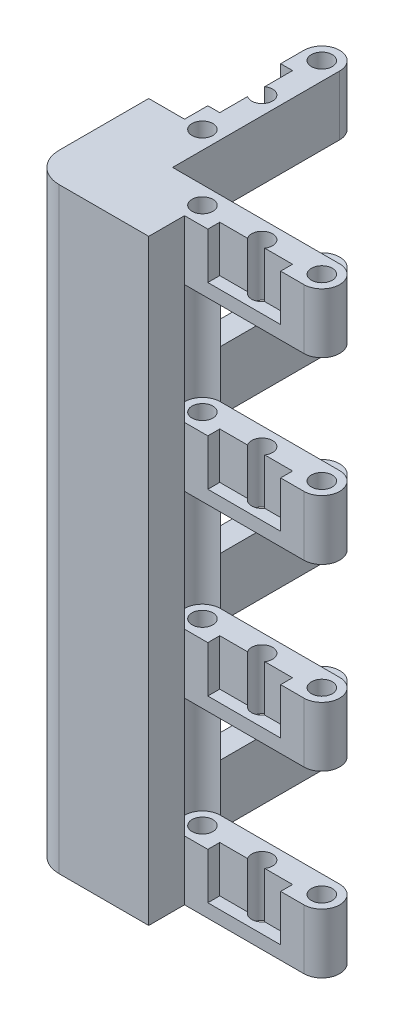
from build123d import *

# Parameters (mm, degrees)
BOSS_EXTRUDE1_DEPTH      = 50
BOSS_EXTRUDE1_DEPTH_BACK = 50
BOSS_EXTRUDE2_DEPTH      = 50
BOSS_EXTRUDE2_DEPTH_BACK = 50
FILLET1_R                = 5
CUT_EXTRUDE2_DEPTH       = 40
CUT_EXTRUDE2_DEPTH_BACK  = 40
BOSS_EXTRUDE3_DEPTH      = 20
BOSS_EXTRUDE3_DEPTH_BACK = 20
CUT_EXTRUDE3_DEPTH       = 10
CUT_EXTRUDE3_DEPTH_BACK  = 10
SKETCH3_R                = 1.75
CUT_EXTRUDE1_DEPTH       = 118.038455219
SKETCH4_W                = 12.2
SKETCH4_H                = 5.5
CUT_EXTRUDE4_DEPTH       = 2
LPATTERN1_COUNT          = 4
LPATTERN1_PITCH          = 30
SKETCH6_W                = 12.2
SKETCH6_H                = 5.5
CUT_EXTRUDE5_DEPTH       = 2
LPATTERN2_COUNT          = 4
LPATTERN2_PITCH          = 30
SKETCH7_W                = 12.2
SKETCH7_H                = 4
CUT_EXTRUDE6_DEPTH       = 2
LPATTERN3_COUNT          = 4
LPATTERN3_PITCH          = 30
SKETCH8_W                = 12.2
SKETCH8_H                = 4
CUT_EXTRUDE7_DEPTH       = 2
LPATTERN4_COUNT          = 4
LPATTERN4_PITCH          = 30


with BuildPart() as part:
    # Sketch1 → Boss-Extrude1 (new, two sides: drawn at the far end of the back side and taken through both)
    with BuildSketch(Plane(origin=(0, 0, 0), x_dir=(1, 0, 0), z_dir=(0, 1, 0)).offset(-BOSS_EXTRUDE1_DEPTH_BACK)):
        Polygon((0, 0), (0, 20), (12, 20), (12, 12), (20, 12), (20, 0), align=None)
    extrude(amount=BOSS_EXTRUDE1_DEPTH + BOSS_EXTRUDE1_DEPTH_BACK)

    # Sketch2 → Boss-Extrude2 (add, two sides: drawn at the far end of the back side and taken through both)
    with BuildSketch(Plane(origin=(0, 0, 0), x_dir=(1, 0, 0), z_dir=(0, 1, 0)).offset(-BOSS_EXTRUDE2_DEPTH_BACK)):
        with BuildLine():
            Line((20, 12), (40, 12))
            ThreePointArc((40, 12), (43, 9), (40, 6))
            Line((40, 6), (20, 6))
            ThreePointArc((20, 6), (17, 9), (20, 12))
        make_face()
        with BuildLine():
            Line((12, 40), (12, 20))
            ThreePointArc((12, 20), (9, 17), (6, 20))
            Line((6, 20), (6, 40))
            ThreePointArc((6, 40), (9, 43), (12, 40))
        make_face()
    extrude(amount=BOSS_EXTRUDE2_DEPTH + BOSS_EXTRUDE2_DEPTH_BACK)

    # Fillet1
    fillet1_edges = [part.edges().sort_by_distance(p)[0] for p in [
        (0, 0, 0),
    ]]
    fillet(fillet1_edges, radius=FILLET1_R)

    # Sketch2<2> → Cut-Extrude2 (cut, two sides: drawn at the far end of the back side and taken through both)
    with BuildSketch(Plane(origin=(0, 0, 0), x_dir=(1, 0, 0), z_dir=(0, 1, 0)).offset(-CUT_EXTRUDE2_DEPTH_BACK)):
        with BuildLine():
            Line((20, 12), (40, 12))
            ThreePointArc((40, 12), (43, 9), (40, 6))
            Line((40, 6), (20, 6))
            ThreePointArc((20, 6), (17, 9), (20, 12))
        make_face()
        with BuildLine():
            Line((12, 40), (12, 20))
            ThreePointArc((12, 20), (9, 17), (6, 20))
            Line((6, 20), (6, 40))
            ThreePointArc((6, 40), (9, 43), (12, 40))
        make_face()
    extrude(amount=CUT_EXTRUDE2_DEPTH + CUT_EXTRUDE2_DEPTH_BACK, mode=Mode.SUBTRACT)

    # Sketch2<3> → Boss-Extrude3 (add, two sides: drawn at the far end of the back side and taken through both)
    with BuildSketch(Plane(origin=(0, 0, 0), x_dir=(1, 0, 0), z_dir=(0, 1, 0)).offset(-BOSS_EXTRUDE3_DEPTH_BACK)):
        with BuildLine():
            Line((20, 12), (40, 12))
            ThreePointArc((40, 12), (43, 9), (40, 6))
            Line((40, 6), (20, 6))
            ThreePointArc((20, 6), (17, 9), (20, 12))
        make_face()
        with BuildLine():
            Line((12, 40), (12, 20))
            ThreePointArc((12, 20), (9, 17), (6, 20))
            Line((6, 20), (6, 40))
            ThreePointArc((6, 40), (9, 43), (12, 40))
        make_face()
    extrude(amount=BOSS_EXTRUDE3_DEPTH + BOSS_EXTRUDE3_DEPTH_BACK)

    # Sketch2<4> → Cut-Extrude3 (cut, two sides: drawn at the far end of the back side and taken through both)
    with BuildSketch(Plane(origin=(0, 0, 0), x_dir=(1, 0, 0), z_dir=(0, 1, 0)).offset(-CUT_EXTRUDE3_DEPTH_BACK)):
        with BuildLine():
            Line((20, 12), (40, 12))
            ThreePointArc((40, 12), (43, 9), (40, 6))
            Line((40, 6), (20, 6))
            ThreePointArc((20, 6), (17, 9), (20, 12))
        make_face()
        with BuildLine():
            Line((12, 40), (12, 20))
            ThreePointArc((12, 20), (9, 17), (6, 20))
            Line((6, 20), (6, 40))
            ThreePointArc((6, 40), (9, 43), (12, 40))
        make_face()
    extrude(amount=CUT_EXTRUDE3_DEPTH + CUT_EXTRUDE3_DEPTH_BACK, mode=Mode.SUBTRACT)

    # Sketch3 → Cut-Extrude1 (cut, through all)
    with BuildSketch(Plane(origin=(0, 50, 0), x_dir=(1, 0, 0), z_dir=(0, 1, 0))):
        with Locations((9, 40)):
            Circle(SKETCH3_R)
        with Locations((9, 20)):
            Circle(SKETCH3_R)
        with Locations((20, 9)):
            Circle(SKETCH3_R)
        with Locations((40, 9)):
            Circle(SKETCH3_R)
        with Locations((30, 9)):
            Circle(SKETCH3_R)
        with Locations((9, 30)):
            Circle(SKETCH3_R)
    extrude(amount=-CUT_EXTRUDE1_DEPTH, mode=Mode.SUBTRACT)

    # Sketch4 → Cut-Extrude4 (cut)
    with BuildSketch(Plane.XY.offset(-6)):
        with Locations((30, 45)):
            Rectangle(SKETCH4_W, SKETCH4_H)
    cut_extrude4 = extrude(amount=-CUT_EXTRUDE4_DEPTH, mode=Mode.SUBTRACT)

    # LPattern1: Cut-Extrude4 ×4
    with Locations(*[(0, -i * LPATTERN1_PITCH, 0) for i in range(1, LPATTERN1_COUNT)]):
        add(cut_extrude4, mode=Mode.SUBTRACT)

    # Sketch6 → Cut-Extrude5 (cut)
    with BuildSketch(Plane.ZY.offset(-6)):
        with Locations((-30, 45)):
            Rectangle(SKETCH6_W, SKETCH6_H)
    cut_extrude5 = extrude(amount=-CUT_EXTRUDE5_DEPTH, mode=Mode.SUBTRACT)

    # LPattern2: Cut-Extrude5 ×4
    with Locations(*[(0, -i * LPATTERN2_PITCH, 0) for i in range(1, LPATTERN2_COUNT)]):
        add(cut_extrude5, mode=Mode.SUBTRACT)

    # Sketch7 → Cut-Extrude6 (cut)
    with BuildSketch(Plane.ZY.offset(-6)):
        with Locations((-30, 49.75)):
            Rectangle(SKETCH7_W, SKETCH7_H)
    cut_extrude6 = extrude(amount=-CUT_EXTRUDE6_DEPTH, mode=Mode.SUBTRACT)

    # LPattern3: Cut-Extrude6 ×4
    with Locations(*[(0, -i * LPATTERN3_PITCH, 0) for i in range(1, LPATTERN3_COUNT)]):
        add(cut_extrude6, mode=Mode.SUBTRACT)

    # Sketch8 → Cut-Extrude7 (cut)
    with BuildSketch(Plane.XY.offset(-6)):
        with Locations((30, 49.75)):
            Rectangle(SKETCH8_W, SKETCH8_H)
    cut_extrude7 = extrude(amount=-CUT_EXTRUDE7_DEPTH, mode=Mode.SUBTRACT)

    # LPattern4: Cut-Extrude7 ×4
    with Locations(*[(0, -i * LPATTERN4_PITCH, 0) for i in range(1, LPATTERN4_COUNT)]):
        add(cut_extrude7, mode=Mode.SUBTRACT)


solid = part.part
